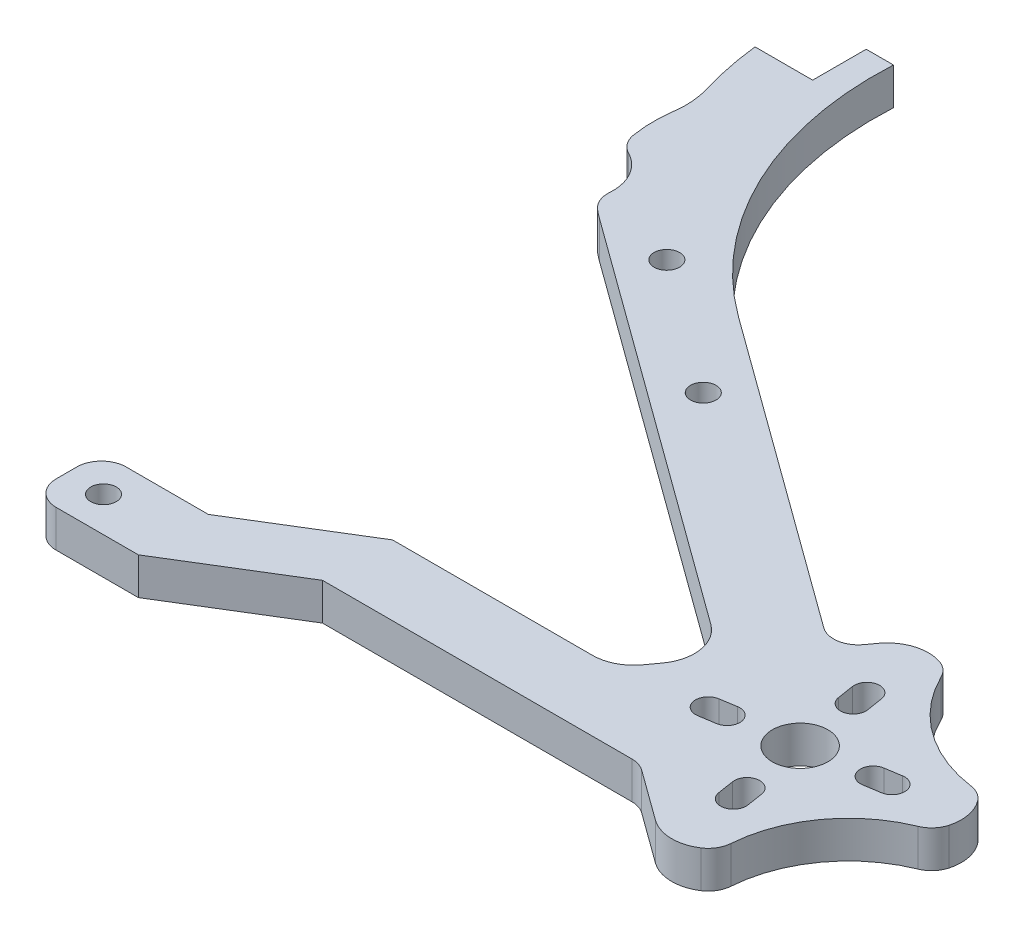
from build123d import *

# Parameters (mm, degrees)
SKETCH_3_R             = 3.375
SKETCH_3_R_2           = 1.55
EXTRUDE_1_DEPTH        = 4.5
FILLET_1_R             = 5
CUT_EXTRUDE_2_REACH    = 155.806
FILLET_3_R             = 3
EXTRUDE_4428_DEPTH     = 4.5
SKETCH_7_R             = 5.5
CUT_EXTRUDE_4738_DEPTH = 154.806186932
FILLET_1_2_R           = 3


with BuildPart() as part:
    # 草图3 → 凸台-拉伸1 (new body)
    with BuildSketch(Plane(origin=(0, 0, 0), x_dir=(1, 0, 0), z_dir=(0, 1, 0))):
        with BuildLine():
            Line((41.131907973, -24.012757507), (94.694386062, -62.928175745))
            Line((94.694386062, -62.928175745), (100.131399646, -55.444768547))
            Line((100.131399646, -55.444768547), (122.783875489, -71.902755611))
            Line((122.783875489, -71.902755611), (106.325888424, -94.555231453))
            Line((106.325888424, -94.555231453), (95.372658906, -86.597244389))
            Line((95.372658906, -86.597244389), (56.836706291, -86.597244389))
            Line((56.836706291, -86.597244389), (42.973762785, -95.097244389))
            Line((42.973762785, -95.097244389), (30, -95.097244389))
            Line((30, -95.097244389), (30, -86.597244389))
            Line((30, -86.597244389), (42.973762785, -86.597244389))
            Line((42.973762785, -86.597244389), (56.836706291, -78.097244389))
            Line((56.836706291, -78.097244389), (83.673412582, -78.097244389))
            Line((83.673412582, -78.097244389), (89.110426166, -70.613837191))
            Line((89.110426166, -70.613837191), (35.547948076, -31.698418954))
            ThreePointArc((35.547948076, -31.698418954), (34.497097301, -25.063608282), (41.131907973, -24.012757507))
        make_face()
        with Locations(Location((103.228644035, -75, 0), (0, 0, 270))):
            Circle(SKETCH_3_R, mode=Mode.SUBTRACT)
        with Locations(Location((44.044221455, -32, 0), (0, 0, 270))):
            Circle(SKETCH_3_R_2, mode=Mode.SUBTRACT)
        with Locations(Location((60.224561343, -43.755705046, 0), (0, 0, 270))):
            Circle(SKETCH_3_R_2, mode=Mode.SUBTRACT)
        with Locations(Location((34.5, -90.847244389, 0), (0, 0, 270))):
            Circle(SKETCH_3_R_2, mode=Mode.SUBTRACT)
        with BuildLine():
            Line((110.640755254, -72.256715968), (112.616131935, -71.943847038))
            ThreePointArc((112.616131935, -71.943847038), (114.389522284, -73.232290545), (113.101078777, -75.005680894))
            Line((113.101078777, -75.005680894), (111.125702096, -75.318549824))
            ThreePointArc((111.125702096, -75.318549824), (109.352311747, -74.030106317), (110.640755254, -72.256715968))
        make_face(mode=Mode.SUBTRACT)
        with BuildLine():
            Line((103.547193859, -67.10294194), (103.234324929, -65.127565258))
            ThreePointArc((103.234324929, -65.127565258), (101.46093458, -63.839121751), (100.172491073, -65.6125121))
            Line((100.172491073, -65.6125121), (100.485360003, -67.587888781))
            ThreePointArc((100.485360003, -67.587888781), (102.258750352, -68.876332288), (103.547193859, -67.10294194))
        make_face(mode=Mode.SUBTRACT)
        with BuildLine():
            Line((95.816532817, -77.743284032), (93.841156135, -78.056152962))
            ThreePointArc((93.841156135, -78.056152962), (92.067765787, -76.767709455), (93.356209294, -74.994319106))
            Line((93.356209294, -74.994319106), (95.331585975, -74.681450176))
            ThreePointArc((95.331585975, -74.681450176), (97.104976324, -75.969893683), (95.816532817, -77.743284032))
        make_face(mode=Mode.SUBTRACT)
        with BuildLine():
            Line((102.910094211, -82.89705806), (103.222963142, -84.872434742))
            ThreePointArc((103.222963142, -84.872434742), (104.99635349, -86.160878249), (106.284796997, -84.3874879))
            Line((106.284796997, -84.3874879), (105.971928067, -82.412111219))
            ThreePointArc((105.971928067, -82.412111219), (104.198537719, -81.123667712), (102.910094211, -82.89705806))
        make_face(mode=Mode.SUBTRACT)
    extrude(amount=EXTRUDE_1_DEPTH)

    # Fillet 1
    fillet_1_edges = [part.edges().sort_by_distance(p)[0] for p in [
        (83.673412582, 2.25, 78.097244389),
        (89.110426166, 2.25, 70.613837191),
        (100.131399646, 2.25, 55.444768547),
        (122.783875489, 2.25, 71.902755611),
        (106.325888424, 2.25, 94.555231453),
    ]]
    fillet(fillet_1_edges, radius=FILLET_1_R)

    # 草图4 → 圆弧-美观2 (cut, up to next)
    with BuildSketch(Plane(origin=(0, 4.5, 0), x_dir=(1, 0, 0), z_dir=(0, 1, 0)), mode=Mode.PRIVATE) as cut_extrude_2_sk1:
        with BuildLine():
            ThreePointArc((118.738790517, -68.963829349), (109.994899962, -65.687047674), (104.176484618, -58.383694808))
            Line((104.176484618, -58.383694808), (118.738790517, -68.963829349))
        make_face()
    cut_extrude_2_tool1 = extrude(cut_extrude_2_sk1.sketch, amount=-CUT_EXTRUDE_2_REACH, mode=Mode.PRIVATE) & part.part
    # 草图4 → 圆弧-美观2 (cut, up to next)
    with BuildSketch(Plane(origin=(0, 4.5, 0), x_dir=(1, 0, 0), z_dir=(0, 1, 0)), mode=Mode.PRIVATE) as cut_extrude_2_sk2:
        with BuildLine():
            ThreePointArc((119.844949227, -75.947840583), (112.204348353, -81.521230905), (109.264814686, -90.510146481))
            Line((109.264814686, -90.510146481), (119.844949227, -75.947840583))
        make_face()
    cut_extrude_2_tool2 = extrude(cut_extrude_2_sk2.sketch, amount=-CUT_EXTRUDE_2_REACH, mode=Mode.PRIVATE) & part.part
    add(cut_extrude_2_tool1.solids().sort_by_distance((110.868828, 4.5, 64.48419))[0], mode=Mode.SUBTRACT)
    add(cut_extrude_2_tool2.solids().sort_by_distance((113.606622, 4.5, 82.540042))[0], mode=Mode.SUBTRACT)

    # 圆角-美观3
    fillet_3_edges = [part.edges().sort_by_distance(p)[0] for p in [
        (119.844949227, 2.25, 75.947840583),
        (109.264814686, 2.25, 90.510146481),
        (118.738790517, 2.25, 68.963829349),
        (104.176484618, 2.25, 58.383694808),
        (95.372658906, 2.25, 86.597244389),
        (30, 2.25, 95.097244389),
        (30, 2.25, 86.597244389),
        (94.694386062, 2.25, 62.928175745),
    ]]
    fillet(fillet_3_edges, radius=FILLET_3_R)

    # 草图5 → Extrude 4428 (add)
    with BuildSketch(Plane(origin=(0, 0, 0), x_dir=(1, 0, 0), z_dir=(0, 1, 0))):
        with BuildLine():
            Line((34, -4.25), (27.002484736, -4.25))
            ThreePointArc((27.002484736, -4.25), (27.592720055, -7.98965282), (28.516665153, -11.661124786))
            ThreePointArc((28.516665153, -11.661124786), (28.909483525, -13.772484831), (28.842431122, -15.919028912))
            ThreePointArc((28.842431122, -15.919028912), (30.008908493, -24.737793116), (35.547948076, -31.698418954))
            ThreePointArc((35.547948076, -31.698418954), (34.497097301, -25.063608282), (41.131907973, -24.012757507))
            Line((41.131907973, -24.012757507), (54.395000648, -33.648958388))
            ThreePointArc((54.395000648, -33.648958388), (41.285942601, -17.872891342), (37.310903062, 2.249999975))
            Line((37.310903062, 2.249999975), (34, 2.249999975))
            Line((34, 2.249999975), (34, -4.25))
        make_face()
    extrude(amount=EXTRUDE_4428_DEPTH)

    # 草图7 → Cut-Extrude 4738 (cut, through all)
    with BuildSketch(Plane(origin=(0, 0, 0), x_dir=(1, 0, 0), z_dir=(0, 1, 0))):
        with Locations((28, -28)):
            Circle(SKETCH_7_R)
    extrude(amount=CUT_EXTRUDE_4738_DEPTH, mode=Mode.SUBTRACT)

    # Fillet 1 2
    fillet_1_2_edges = [part.edges().sort_by_distance(p)[0] for p in [
        (33.239893047, 2.25, 29.671382916),
        (29.281526942, 2.25, 22.651384413),
    ]]
    fillet(fillet_1_2_edges, radius=FILLET_1_2_R)


solid = part.part
